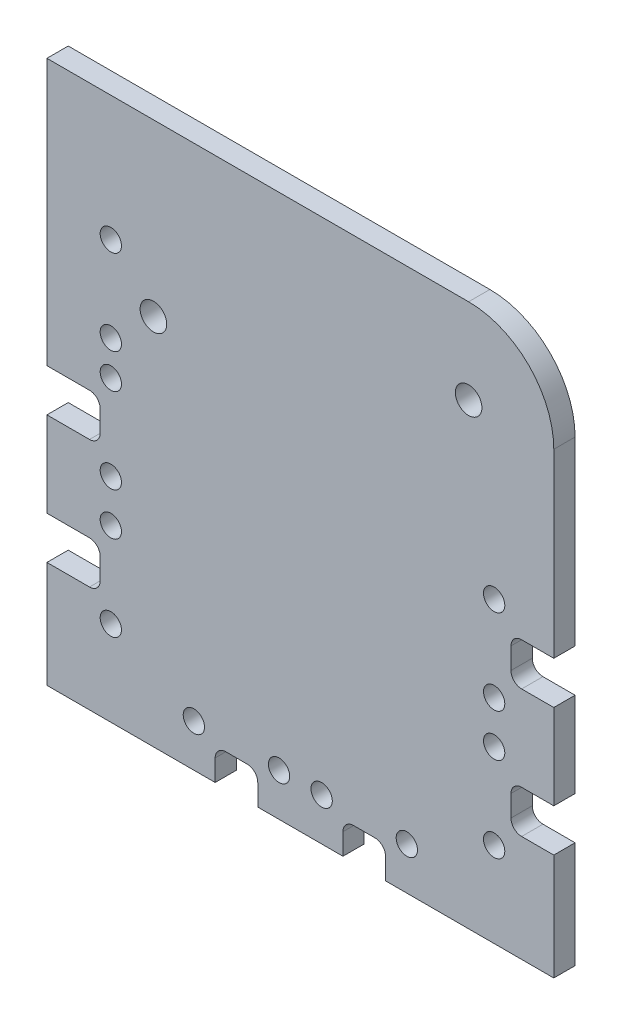
from build123d import *

# Parameters (mm, degrees)
SKETCH_1_R      = 1.25
SKETCH_1_R_2    = 1
EXTRUDE_2_DEPTH = 2


with BuildPart() as part:
    # 草圖1 → 填料-伸長2 (new body)
    with BuildSketch(Plane.XY):
        with BuildLine():
            Line((19.058094933, -28.1179941), (19.058094933, -12.6179941))
            ThreePointArc((19.058094933, -12.6179941), (16.714949182, -6.961139851), (11.058094933, -4.6179941))
            Line((11.058094933, -4.6179941), (-7.541905067, -4.6179941))
            Line((-7.541905067, -4.6179941), (-27.541905067, -4.6179941))
            Line((-27.541905067, -4.6179941), (-28.541905067, -4.6179941))
            Line((-28.541905067, -4.6179941), (-28.541905067, -5.6179941))
            Line((-28.541905067, -5.6179941), (-28.541905067, -12.6179941))
            Line((-28.541905067, -12.6179941), (-28.541905067, -28.1179941))
            Line((-28.541905067, -28.1179941), (-28.541905067, -29.6179941))
            Line((-28.541905067, -29.6179941), (-26.541905067, -29.6179941))
            Line((-26.541905067, -29.6179941), (-24.541905067, -29.6179941))
            ThreePointArc((-24.541905067, -29.6179941), (-23.834798286, -29.910887319), (-23.541905067, -30.6179941))
            Line((-23.541905067, -30.6179941), (-23.541905067, -32.6179941))
            ThreePointArc((-23.541905067, -32.6179941), (-23.834798286, -33.325100881), (-24.541905067, -33.6179941))
            Line((-24.541905067, -33.6179941), (-26.541905067, -33.6179941))
            Line((-26.541905067, -33.6179941), (-28.541905067, -33.6179941))
            Line((-28.541905067, -33.6179941), (-28.541905067, -41.6179941))
            Line((-28.541905067, -41.6179941), (-26.541905067, -41.6179941))
            Line((-26.541905067, -41.6179941), (-24.541905067, -41.6179941))
            ThreePointArc((-24.541905067, -41.6179941), (-23.834798286, -41.910887319), (-23.541905067, -42.6179941))
            Line((-23.541905067, -42.6179941), (-23.541905067, -44.6179941))
            ThreePointArc((-23.541905067, -44.6179941), (-23.834798286, -45.325100881), (-24.541905067, -45.6179941))
            Line((-24.541905067, -45.6179941), (-26.541905067, -45.6179941))
            Line((-26.541905067, -45.6179941), (-28.541905067, -45.6179941))
            Line((-28.541905067, -45.6179941), (-28.541905067, -52.6179941))
            Line((-28.541905067, -52.6179941), (-28.541905067, -53.6179941))
            Line((-28.541905067, -53.6179941), (-28.541905067, -55.6179941))
            Line((-28.541905067, -55.6179941), (-12.741905067, -55.6179941))
            Line((-12.741905067, -55.6179941), (-12.741905067, -53.6179941))
            ThreePointArc((-12.741905067, -53.6179941), (-12.449011848, -52.910887319), (-11.741905067, -52.6179941))
            Line((-11.741905067, -52.6179941), (-9.741905067, -52.6179941))
            ThreePointArc((-9.741905067, -52.6179941), (-9.034798286, -52.910887319), (-8.741905067, -53.6179941))
            Line((-8.741905067, -53.6179941), (-8.741905067, -55.6179941))
            Line((-8.741905067, -55.6179941), (-0.741905067, -55.6179941))
            Line((-0.741905067, -55.6179941), (-0.741905067, -53.6179941))
            ThreePointArc((-0.741905067, -53.6179941), (-0.449011848, -52.910887319), (0.258094933, -52.6179941))
            Line((0.258094933, -52.6179941), (2.258094933, -52.6179941))
            ThreePointArc((2.258094933, -52.6179941), (2.965201714, -52.910887319), (3.258094933, -53.6179941))
            Line((3.258094933, -53.6179941), (3.258094933, -55.6179941))
            Line((3.258094933, -55.6179941), (19.058094933, -55.6179941))
            Line((19.058094933, -55.6179941), (19.058094933, -53.6179941))
            Line((19.058094933, -53.6179941), (19.058094933, -52.6179941))
            Line((19.058094933, -52.6179941), (19.058094933, -45.6179941))
            Line((19.058094933, -45.6179941), (18.039175344, -45.6179941))
            Line((18.039175344, -45.6179941), (16.039175344, -45.6179941))
            ThreePointArc((16.039175344, -45.6179941), (15.332068562, -45.325100881), (15.039175344, -44.6179941))
            Line((15.039175344, -44.6179941), (15.039175344, -42.6179941))
            ThreePointArc((15.039175344, -42.6179941), (15.332068562, -41.910887319), (16.039175344, -41.6179941))
            Line((16.039175344, -41.6179941), (18.039175344, -41.6179941))
            Line((18.039175344, -41.6179941), (19.058094933, -41.6179941))
            Line((19.058094933, -41.6179941), (19.058094933, -33.6179941))
            Line((19.058094933, -33.6179941), (18.039175344, -33.6179941))
            Line((18.039175344, -33.6179941), (16.039175344, -33.6179941))
            ThreePointArc((16.039175344, -33.6179941), (15.332068562, -33.325100881), (15.039175344, -32.6179941))
            Line((15.039175344, -32.6179941), (15.039175344, -30.6179941))
            ThreePointArc((15.039175344, -30.6179941), (15.332068562, -29.910887319), (16.039175344, -29.6179941))
            Line((16.039175344, -29.6179941), (18.039175344, -29.6179941))
            Line((18.039175344, -29.6179941), (19.058094933, -29.6179941))
            Line((19.058094933, -29.6179941), (19.058094933, -28.1179941))
        make_face()
        with Locations((-18.541905067, -20.6179941)):
            Circle(SKETCH_1_R, mode=Mode.SUBTRACT)
        with Locations((-6.741905067, -51.6179941)):
            Circle(SKETCH_1_R_2, mode=Mode.SUBTRACT)
        with Locations((-14.741905067, -51.6179941)):
            Circle(SKETCH_1_R_2, mode=Mode.SUBTRACT)
        with Locations((5.258094933, -51.6179941)):
            Circle(SKETCH_1_R_2, mode=Mode.SUBTRACT)
        with Locations((-22.541905067, -16.3679941)):
            Circle(SKETCH_1_R_2, mode=Mode.SUBTRACT)
        with Locations((-22.541905067, -24.3679941)):
            Circle(SKETCH_1_R_2, mode=Mode.SUBTRACT)
        with Locations((13.458094933, -39.6179941)):
            Circle(SKETCH_1_R_2, mode=Mode.SUBTRACT)
        with Locations((13.458094933, -47.6179941)):
            Circle(SKETCH_1_R_2, mode=Mode.SUBTRACT)
        with Locations((11.058094933, -12.6179941)):
            Circle(SKETCH_1_R, mode=Mode.SUBTRACT)
        with Locations((-22.541905067, -27.6179941)):
            Circle(SKETCH_1_R_2, mode=Mode.SUBTRACT)
        with Locations((-22.541905067, -35.6179941)):
            Circle(SKETCH_1_R_2, mode=Mode.SUBTRACT)
        with Locations((-2.741905067, -51.6179941)):
            Circle(SKETCH_1_R_2, mode=Mode.SUBTRACT)
        with Locations((-22.541905067, -39.6179941)):
            Circle(SKETCH_1_R_2, mode=Mode.SUBTRACT)
        with Locations((-22.541905067, -47.6179941)):
            Circle(SKETCH_1_R_2, mode=Mode.SUBTRACT)
        with Locations((13.458094933, -27.6179941)):
            Circle(SKETCH_1_R_2, mode=Mode.SUBTRACT)
        with Locations((13.458094933, -35.6179941)):
            Circle(SKETCH_1_R_2, mode=Mode.SUBTRACT)
    extrude(amount=EXTRUDE_2_DEPTH)


solid = part.part
